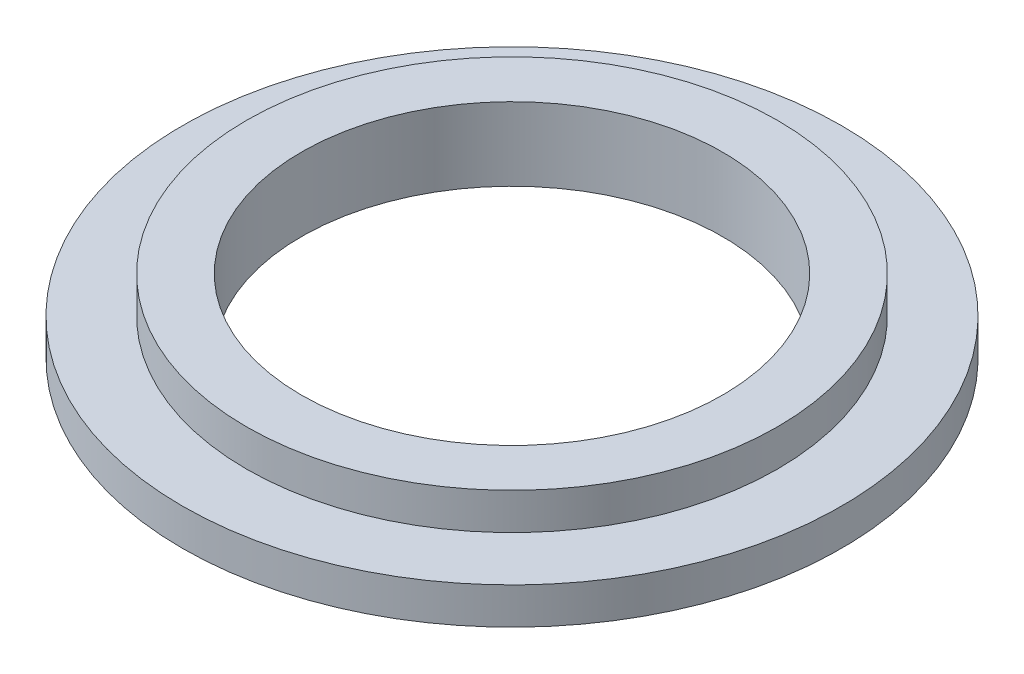
from build123d import *

# Parameters (mm, degrees)
SKETCH1_R               = 18
BOSS_EXTRUDE1_DEPTH     = 2
SKETCH2_R               = 14.5
BOSS_EXTRUDE2_DEPTH     = 2
CUT_EXTRUDE3_DEPTH      = 26.768197453
CUT_EXTRUDE3_DEPTH_BACK = 26.768197453
SKETCH3_R               = 11.5


with BuildPart() as part:
    # Sketch1 → Boss-Extrude1 (new body)
    with BuildSketch(Plane(origin=(0, 0, 0), x_dir=(1, 0, 0), z_dir=(0, 1, 0))):
        with Locations(Location((0, 0, 0), (0, 0, 270))):
            Circle(SKETCH1_R)
    extrude(amount=BOSS_EXTRUDE1_DEPTH)

    # Sketch2 → Boss-Extrude2 (add)
    with BuildSketch(Plane(origin=(0, 2, 0), x_dir=(1, 0, 0), z_dir=(0, 1, 0))):
        with Locations(Location((0, 0, 0), (0, 0, 270))):
            Circle(SKETCH2_R)
    extrude(amount=BOSS_EXTRUDE2_DEPTH)

    # Sketch3 → Cut-Extrude3 (cut, two sides: drawn at the far end of the back side and taken through both)
    with BuildSketch(Plane(origin=(0, 0, 0), x_dir=(1, 0, 0), z_dir=(0, 1, 0)).offset(-CUT_EXTRUDE3_DEPTH_BACK)):
        with Locations(Location((0, 0, 0), (0, 0, 270))):
            Circle(SKETCH3_R)
    extrude(amount=CUT_EXTRUDE3_DEPTH + CUT_EXTRUDE3_DEPTH_BACK, mode=Mode.SUBTRACT)


solid = part.part
